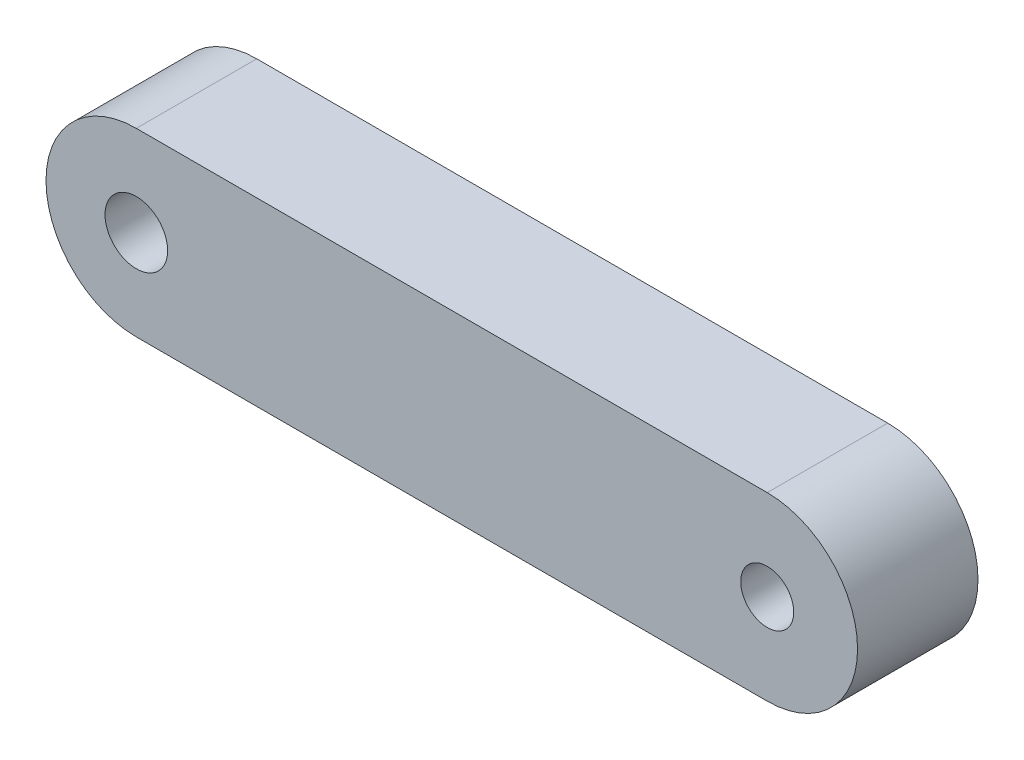
from build123d import *

# Parameters (mm, degrees)
SKETCH1_R           = 1.3969
SKETCH1_R_2         = 1.65
BOSS_EXTRUDE1_DEPTH = 6.35
SKETCH2_R           = 3.1
CUT_EXTRUDE1_DEPTH  = 3.75000012


with BuildPart() as part:
    # Sketch1 → Boss-Extrude1 (new body)
    with BuildSketch(Plane.XY):
        with BuildLine():
            Line((-16.632351927, 4.7625), (16.632351927, 4.7625))
            ThreePointArc((16.632351927, 4.7625), (21.394851927, 0), (16.632351927, -4.7625))
            Line((16.632351927, -4.7625), (-16.632351927, -4.7625))
            ThreePointArc((-16.632351927, -4.7625), (-21.394851927, 0), (-16.632351927, 4.7625))
        make_face()
        with Locations((16.632351927, 0)):
            Circle(SKETCH1_R, mode=Mode.SUBTRACT)
        with Locations((-16.632351927, 0)):
            Circle(SKETCH1_R_2, mode=Mode.SUBTRACT)
    extrude(amount=BOSS_EXTRUDE1_DEPTH)

    # Sketch2 → Cut-Extrude1 (cut)
    with BuildSketch(Plane(origin=(0, 0, 0), x_dir=(-1, 0, 0), z_dir=(0, 0, -1))):
        with Locations((16.632351927, 0)):
            Circle(SKETCH2_R)
    extrude(amount=-CUT_EXTRUDE1_DEPTH, mode=Mode.SUBTRACT)


solid = part.part
